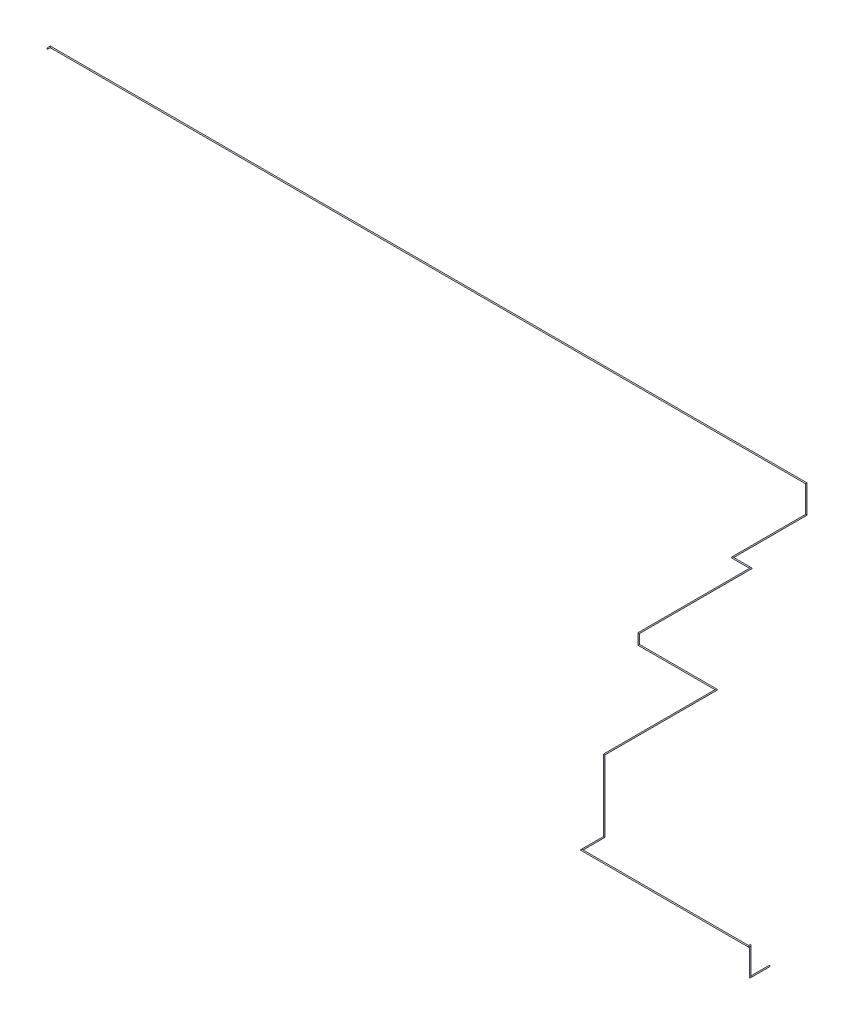
from build123d import *

# Parameters (mm, degrees)
CROQUIS1_R              = 19.05
SALIENTE_EXTRUIR1_DEPTH = 10
CROQUIS2_R              = 19.05
CROQUIS3_W              = 0.28062043
CROQUIS3_H              = 0.25370786
SALIENTE_EXTRUIR2_DEPTH = 1


with BuildPart() as part:
    # Croquis1 → Saliente-Extruir1 (new body)
    with BuildSketch(Plane.XY):
        Circle(CROQUIS1_R)
    extrude(amount=SALIENTE_EXTRUIR1_DEPTH)

    # Barrer1: sweep along a curve in space
    with BuildLine() as barrer1_path:
        Line((0, 0, 10), (0, 0, 660))
        Line((0, 0, 660), (0, 950, 660))
        Line((0, 950, 660), (0, 950, 720))
        Line((0, 950, 720), (-5800, 950, 720))
        Line((-5800, 950, 720), (-5800, 950, -60))
        Line((-5800, 950, -60), (-5800, 3430, -60))
        Line((-5800, 3430, -60), (-5800, 3430, -3960))
        Line((-5800, 3430, -3960), (-8500, 3430, -3960))
        Line((-8500, 3430, -3960), (-8500, 3780, -3960))
        Line((-8500, 3780, -3960), (-8500, 3780, -7860))
        Line((-8500, 3780, -7860), (-9150, 3780, -7860))
        Line((-9150, 3780, -7860), (-9150, 3780, -10430))
        Line((-9150, 3780, -10430), (-9150, 4725, -10430))
        Line((-9150, 4725, -10430), (-35400, 4725, -10430))
        Line((-35400, 4725, -10430), (-35400, 4725, -10330))
    # Croquis2 → Barrer1 (sweep)
    with BuildSketch(Plane.XY.offset(10)):
        Circle(CROQUIS2_R)
    sweep(path=barrer1_path.line, transition=Transition.RIGHT)

    # Croquis3 → Saliente-Extruir2 (add)
    with BuildSketch(Plane(origin=(0, 0, 0), x_dir=(-1, 0, 0), z_dir=(0, 0, -1))):
        with Locations((-19.05, 0)):
            Rectangle(CROQUIS3_W, CROQUIS3_H)
    extrude(amount=-SALIENTE_EXTRUIR2_DEPTH)


solid = part.part
